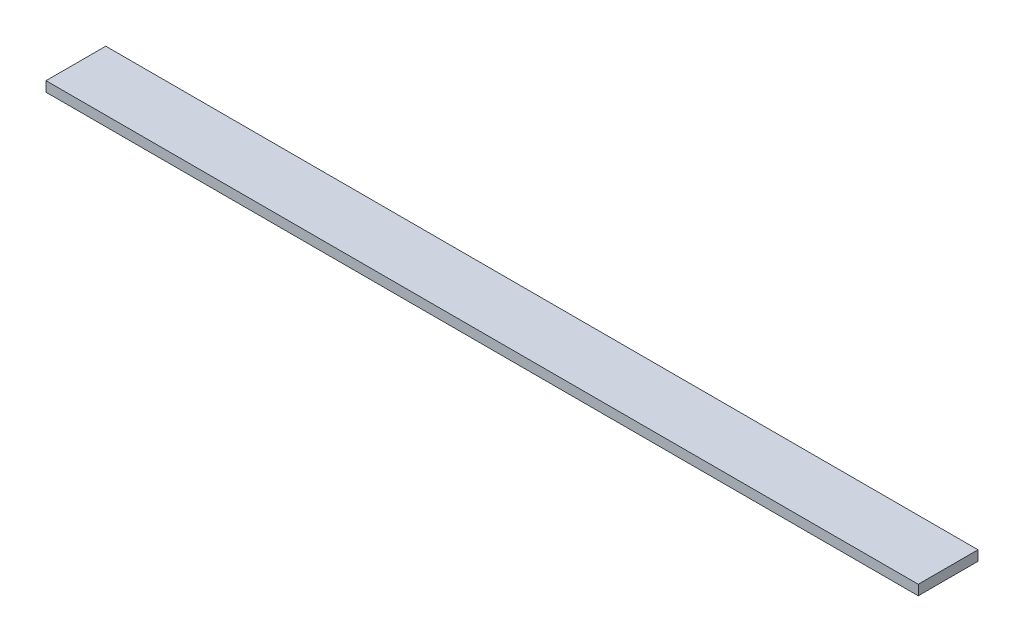
from build123d import *

# Parameters (mm, degrees)
SKETCH1_W           = 137
SKETCH1_H           = 23
BOSS_EXTRUDE1_DEPTH = 2000


with BuildPart() as part:
    # Sketch1 → Boss-Extrude1 (new body)
    with BuildSketch(Plane(origin=(0, 0, 0), x_dir=(0, 0, -1), z_dir=(1, 0, 0))):
        Rectangle(SKETCH1_W, SKETCH1_H)
    extrude(amount=BOSS_EXTRUDE1_DEPTH)


solid = part.part
